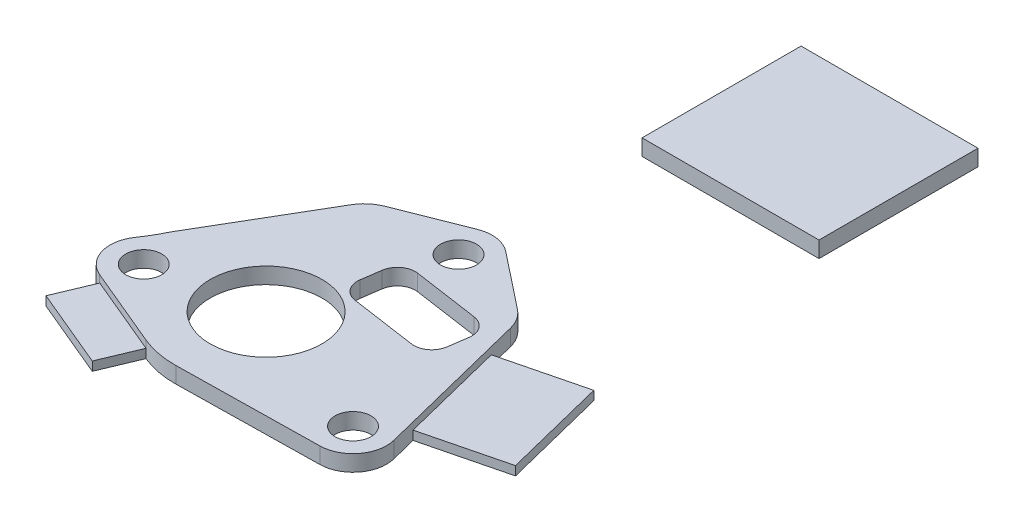
from build123d import *

# Parameters (mm, degrees)
BOSS_EXTRUDE4_DEPTH              = 4.7625
CUT_EXTRUDE1_REACH               = 271.353
SKETCH6_R                        = 14.26845
SKETCH6_R_2                      = 22.86
CUT_EXTRUDE2_REACH               = 271.353
SKETCH7_R                        = 18.48095
CUT_EXTRUDE4_DEPTH               = 270.352829076
BOSS_EXTRUDE9_START              = -4.7625
BOSS_EXTRUDE9_DEPTH              = 4.7625
FILLET1_R                        = 7.62
F_10_CLEARANCE_HOLE1_D           = 4.9784
FILLET4_R                        = 50.8
F_8_32_TAPPED_HOLE1_D            = 3.4544
PIVOTING_BEAM_SENSOR_MOUNT_REACH = 271.268
SKETCH37_R                       = 1.5
SKETCH38_R                       = 7.91845
ENCODER_BOARD_ADDON_DEPTH        = 4.7625
F_10_32_TAPPED_HOLE1_D           = 4.0386
F_10_CLEARANCE_HOLE3_D           = 5.1054
SKETCH47_OUTSIDE_W               = 192.439
SKETCH47_OUTSIDE_H               = 382.734
SKETCH47_OUTSIDE_R               = 2.5527
CUT_EXTRUDE8_DEPTH               = 270.267923318
SKETCH47_2_R                     = 2.5527
CUT_EXTRUDE9_DEPTH               = 2.4765
BOSS_EXTRUDE17_DEPTH             = 1.27
SKETCH59_W                       = 25.070606449
SKETCH59_H                       = 22.525049467
BOSS_EXTRUDE18_DEPTH             = 2.286


with BuildPart() as part:
    # Sketch1 → Boss-Extrude4 (new body)
    with BuildSketch(Plane(origin=(0, 0, 0), x_dir=(1, 0, 0), z_dir=(0, 1, 0))):
        with BuildLine():
            Line((-48.759061319, 205.201963751), (-63.900240413, 124.413609674))
            Line((-63.900240413, 124.413609674), (-26.343120253, -7.50014102))
            ThreePointArc((-26.343120253, -7.50014102), (3.91326684, -27.109010359), (27.388801541, 0.256222825))
            ThreePointArc((27.388801541, 0.256222825), (34.508498918, 53.661639681), (56.295976161, 102.93774419))
            ThreePointArc((56.295976161, 102.93774419), (56.986751486, 124.47275891), (38.624985881, 135.745717413))
            ThreePointArc((38.624985881, 135.745717413), (4.94281576, 154.646064466), (1.637545013, 193.127058321))
            Line((1.637545013, 193.127058321), (18.706481277, 233.364638746))
            ThreePointArc((18.706481277, 233.364638746), (10.708035835, 258.569637187), (-15.424905572, 254.527799821))
            Line((-15.424905572, 254.527799821), (-37.390675283, 228.913568565))
            ThreePointArc((-37.390675283, 228.913568565), (-44.635714299, 217.806104366), (-48.759061319, 205.201963751))
        make_face()
    extrude(amount=BOSS_EXTRUDE4_DEPTH)

    # Sketch6 → Cut-Extrude1 (cut, up to next)
    with BuildSketch(Plane(origin=(0, 4.7625, 0), x_dir=(1, 0, 0), z_dir=(0, 1, 0)), mode=Mode.PRIVATE) as cut_extrude1_sk1:
        with Locations(Location((38.1, 114.3, 0), (0, 0, 270))):
            Circle(SKETCH6_R)
    cut_extrude1_tool1 = extrude(cut_extrude1_sk1.sketch, amount=-CUT_EXTRUDE1_REACH, mode=Mode.PRIVATE) & part.part
    # Sketch6 → Cut-Extrude1 (cut, up to next)
    with BuildSketch(Plane(origin=(0, 4.7625, 0), x_dir=(1, 0, 0), z_dir=(0, 1, 0)), mode=Mode.PRIVATE) as cut_extrude1_sk2:
        with Locations(Location((-4.294087555, 47.653799352, 0), (0, 0, 270))):
            Circle(SKETCH6_R_2)
    cut_extrude1_tool2 = extrude(cut_extrude1_sk2.sketch, amount=-CUT_EXTRUDE1_REACH, mode=Mode.PRIVATE) & part.part
    # Sketch6 → Cut-Extrude1 (cut, up to next)
    with BuildSketch(Plane(origin=(0, 4.7625, 0), x_dir=(1, 0, 0), z_dir=(0, 1, 0)), mode=Mode.PRIVATE) as cut_extrude1_sk3:
        with Locations(Location((-25.238541156, 93.240320194, 0), (0, 0, 270))):
            Circle(SKETCH6_R)
    cut_extrude1_tool3 = extrude(cut_extrude1_sk3.sketch, amount=-CUT_EXTRUDE1_REACH, mode=Mode.PRIVATE) & part.part
    # Sketch6 → Cut-Extrude1 (cut, up to next)
    with BuildSketch(Plane(origin=(0, 4.7625, 0), x_dir=(1, 0, 0), z_dir=(0, 1, 0)), mode=Mode.PRIVATE) as cut_extrude1_sk4:
        with Locations(Location((-31.378993813, 133.413749735, 0), (0, 0, 270))):
            Circle(SKETCH6_R)
    cut_extrude1_tool4 = extrude(cut_extrude1_sk4.sketch, amount=-CUT_EXTRUDE1_REACH, mode=Mode.PRIVATE) & part.part
    # Sketch6 → Cut-Extrude1 (cut, up to next)
    with BuildSketch(Plane(origin=(0, 4.7625, 0), x_dir=(1, 0, 0), z_dir=(0, 1, 0)), mode=Mode.PRIVATE) as cut_extrude1_sk5:
        with Locations(Location((0, 241.3, 0), (0, 0, 270))):
            Circle(SKETCH6_R)
    cut_extrude1_tool5 = extrude(cut_extrude1_sk5.sketch, amount=-CUT_EXTRUDE1_REACH, mode=Mode.PRIVATE) & part.part
    add(cut_extrude1_tool1.solids().sort_by_distance((38.1, 4.7625, -114.3))[0], mode=Mode.SUBTRACT)
    add(cut_extrude1_tool2.solids().sort_by_distance((-4.294088, 4.7625, -47.653799))[0], mode=Mode.SUBTRACT)
    add(cut_extrude1_tool3.solids().sort_by_distance((-25.238541, 4.7625, -93.24032))[0], mode=Mode.SUBTRACT)
    add(cut_extrude1_tool4.solids().sort_by_distance((-31.378994, 4.7625, -133.41375))[0], mode=Mode.SUBTRACT)
    add(cut_extrude1_tool5.solids().sort_by_distance((0, 4.7625, -241.3))[0], mode=Mode.SUBTRACT)

    # Sketch7 → Cut-Extrude2 (cut, up to next)
    with BuildSketch(Plane(origin=(0, 4.7625, 0), x_dir=(1, 0, 0), z_dir=(0, 1, 0)), mode=Mode.PRIVATE) as cut_extrude2_sk1:
        with Locations(Location((0, 0, 0), (0, 0, 270))):
            Circle(SKETCH7_R)
    cut_extrude2_tool1 = extrude(cut_extrude2_sk1.sketch, amount=-CUT_EXTRUDE2_REACH, mode=Mode.PRIVATE) & part.part
    add(cut_extrude2_tool1.solids().sort_by_distance((0, 4.7625, 0))[0], mode=Mode.SUBTRACT)

    # Sketch11 → Cut-Extrude4 (cut, through all)
    with BuildSketch(Plane(origin=(0, 4.7625, 0), x_dir=(1, 0, 0), z_dir=(0, 1, 0))):
        with BuildLine():
            Line((-14.24681913, 167.157327815), (-22.781165939, 169.646710179))
            ThreePointArc((-22.781165939, 169.646710179), (-24.940081812, 173.583756312), (-21.003035679, 175.742672185))
            Line((-21.003035679, 175.742672185), (-12.46868887, 173.253289821))
            ThreePointArc((-12.46868887, 173.253289821), (-10.309772997, 169.316243688), (-14.24681913, 167.157327815))
        make_face()
    extrude(amount=-CUT_EXTRUDE4_DEPTH, mode=Mode.SUBTRACT)

    # Sketch22 → Boss-Extrude9 (add)
    with BuildSketch(Plane(origin=(0, 4.7625, 0), x_dir=(1, 0, 0), z_dir=(0, 1, 0)).offset(BOSS_EXTRUDE9_START)):
        with BuildLine():
            Line((44.13587102, -0.238974107), (45.721176973, 83.59457079))
            ThreePointArc((45.721176973, 83.59457079), (31.828729714, 42.965057017), (27.388801541, 0.256222825))
            ThreePointArc((27.388801541, 0.256222825), (27.389946843, 0.053962259), (27.389598514, -0.14830125))
            Line((27.389598514, -0.14830125), (44.13587102, -0.238974107))
        make_face()
        with BuildLine():
            Line((-26.343120253, -7.50014102), (-63.900240413, 124.413609674))
            Line((-63.900240413, 124.413609674), (-58.659130106, 55.341604227))
            ThreePointArc((-58.659130106, 55.341604227), (-58.57862185, 54.70676299), (-58.434627096, 54.083248366))
            Line((-58.434627096, 54.083248366), (-39.267840062, -13.237215919))
            Line((-39.267840062, -13.237215919), (-25.732483938, -9.383569172))
            ThreePointArc((-25.732483938, -9.383569172), (-26.054826105, -8.447374541), (-26.343120253, -7.50014102))
        make_face()
    extrude(amount=BOSS_EXTRUDE9_DEPTH)

    # Fillet1
    fillet1_edges = [part.edges().sort_by_distance(p)[0] for p in [
        (44.13587102, 2.38125, 0.238974107),
        (27.389598514, 2.38125, 0.14830125),
        (45.721176973, 2.38125, -83.59457079),
        (-25.732483938, 2.38125, 9.383569172),
    ]]
    fillet(fillet1_edges, radius=FILLET1_R)

    # #10 Clearance Hole1 (through all)
    with Locations(Plane(origin=(0, 4.7625, 0), x_dir=(1, 0, 0), z_dir=(0, 1, 0))):
        with Locations((-20.169087555, 23.894274946), (-52.327331966, 55.822054335), (31.486575952, 69.734116153), (0.686224782, 152.463749735), (-32.612193782, 193.553892754), (-52.098807962, 161.528602156)):
            Hole(F_10_CLEARANCE_HOLE1_D / 2)

    # Fillet4
    fillet4_edges = [part.edges().sort_by_distance(p)[0] for p in [
        (-63.900240413, 2.38125, -124.413609674),
    ]]
    fillet(fillet4_edges, radius=FILLET4_R)

    # #8-32 Tapped Hole1 (through all)
    with Locations(Plane(origin=(0, 4.7625, 0), x_dir=(1, 0, 0), z_dir=(0, 1, 0))):
        with Locations((1.914830287, -21.24990167), (13.247190201, 16.725335505), (-17.940310329, 11.548599972)):
            Hole(F_8_32_TAPPED_HOLE1_D / 2)

    # Sketch37 → Pivoting Beam Sensor Mount (cut, up to next)
    with BuildSketch(Plane.XZ, mode=Mode.PRIVATE) as pivoting_beam_sensor_mount_sk1:
        with Locations(Location((23.083384984, -92.174973762, 0), (0, 0, 270))):
            Circle(SKETCH37_R)
    pivoting_beam_sensor_mount_tool1 = extrude(pivoting_beam_sensor_mount_sk1.sketch, amount=-PIVOTING_BEAM_SENSOR_MOUNT_REACH, mode=Mode.PRIVATE) & part.part
    # Sketch37 → Pivoting Beam Sensor Mount (cut, up to next)
    with BuildSketch(Plane.XZ, mode=Mode.PRIVATE) as pivoting_beam_sensor_mount_sk2:
        with BuildLine():
            ThreePointArc((-3.647543534, -89.163751321), (-3.541377345, -96.013206549), (-1.708587973, -102.613751321))
            ThreePointArc((-1.708587973, -102.613751321), (0.255952019, -103.414115377), (1.056316075, -101.449575385))
            ThreePointArc((1.056316075, -101.449575385), (-0.572072996, -95.585150848), (-0.666399089, -89.499575385))
            ThreePointArc((-0.666399089, -89.499575385), (-1.989059279, -87.841091131), (-3.647543534, -89.163751321))
        make_face()
    pivoting_beam_sensor_mount_tool2 = extrude(pivoting_beam_sensor_mount_sk2.sketch, amount=-PIVOTING_BEAM_SENSOR_MOUNT_REACH, mode=Mode.PRIVATE) & part.part
    add(pivoting_beam_sensor_mount_tool1.solids().sort_by_distance((23.083385, 0, -92.174974))[0], mode=Mode.SUBTRACT)
    add(pivoting_beam_sensor_mount_tool2.solids().sort_by_distance((-1.700962, 0, -95.747892))[0], mode=Mode.SUBTRACT)

    # Sketch38 → Encoder Board Addon (add)
    with BuildSketch(Plane(origin=(0, 4.7625, 0), x_dir=(1, 0, 0), z_dir=(0, 1, 0))):
        with BuildLine():
            Line((-37.529034093, -19.344511049), (-39.267840062, -13.237215919))
            Line((-39.267840062, -13.237215919), (-31.839812047, -11.12238453))
            ThreePointArc((-31.839812047, -11.12238453), (-27.003669081, -11.344505665), (-23.277388672, -14.435209614))
            ThreePointArc((-23.277388672, -14.435209614), (-5.966086008, -26.732338427), (14.931018089, -22.962508548))
            ThreePointArc((14.931018089, -22.962508548), (8.591508195, -29.075813245), (4.9829433, -37.109501029))
            Line((4.9829433, -37.109501029), (2.47141259, -47.765086321))
            ThreePointArc((2.47141259, -47.765086321), (0.822880543, -50.381887664), (-2.085320348, -51.434348945))
            Line((-2.085320348, -51.434348945), (-22.168826979, -51.766465319))
            ThreePointArc((-22.168826979, -51.766465319), (-24.841143263, -51.533840241), (-27.408807967, -50.757640062))
            Line((-27.408807967, -50.757640062), (-38.693349579, -46.027393508))
            ThreePointArc((-38.693349579, -46.027393508), (-41.42356145, -42.97092165), (-40.768594617, -38.925294934))
            ThreePointArc((-40.768594617, -38.925294934), (-36.952648742, -29.498249601), (-37.529034093, -19.344511049))
        make_face()
        with Locations(Location((-22.38375, -38.769792264, 0), (0, 0, 270))):
            Circle(SKETCH38_R, mode=Mode.SUBTRACT)
    extrude(amount=-ENCODER_BOARD_ADDON_DEPTH)

    # #10-32 Tapped Hole1 (through all)
    with Locations(Plane(origin=(0, 4.7625, 0), x_dir=(1, 0, 0), z_dir=(0, 1, 0))):
        with Locations((-2.164065959, -46.6725), (-36.852219401, -41.635167886), (-15.755793253, -18.133994079)):
            Hole(F_10_32_TAPPED_HOLE1_D / 2)

    # #10 Clearance Hole3 (through all)
    with Locations(Plane(origin=(0, 4.7625, 0), x_dir=(1, 0, 0), z_dir=(0, 1, 0))):
        with Locations((-36.852219401, -41.635167886), (-2.164065959, -46.6725)):
            Hole(F_10_CLEARANCE_HOLE3_D / 2)

    # Sketch47 outside → Cut-Extrude8 (cut, through all)
    # profile 1 of 3: a face of its own
    with BuildSketch(Plane(origin=(0, 4.7625, 0), x_dir=(1, 0, 0), z_dir=(0, 1, 0))):
        with Locations((-1.9945, 104.926)):
            Rectangle(SKETCH47_OUTSIDE_W, SKETCH47_OUTSIDE_H)
        with BuildLine():
            Line((-38.693349579, -46.027393508), (-27.408807967, -50.757640062))
            ThreePointArc((-27.408807967, -50.757640062), (-24.841143263, -51.533840241), (-22.168826979, -51.766465319))
            Line((-22.168826979, -51.766465319), (-2.085320348, -51.434348945))
            ThreePointArc((-2.085320348, -51.434348945), (1.613604275, -49.572605834), (2.456445703, -45.518256427))
            Line((2.456445703, -45.518256427), (-3.055299638, -23.454383414))
            ThreePointArc((-3.055299638, -23.454383414), (-3.715825704, -21.93050709), (-4.832568275, -20.701125227))
            Line((-4.832568275, -20.701125227), (-12.801470938, -14.398570955))
            ThreePointArc((-12.801470938, -14.398570955), (-15.063238725, -13.422118181), (-17.510319119, -13.706461444))
            Line((-17.510319119, -13.706461444), (-26.955722074, -17.449449957))
            ThreePointArc((-26.955722074, -17.449449957), (-28.392130747, -18.316742481), (-29.467648755, -19.604658322))
            Line((-29.467648755, -19.604658322), (-40.96167653, -39.228143092))
            ThreePointArc((-40.96167653, -39.228143092), (-41.369942708, -43.14234484), (-38.693349579, -46.027393508))
        make_face(mode=Mode.SUBTRACT)
    # profile 2 of 3: a face of its own
    with BuildSketch(Plane(origin=(0, 4.7625, 0), x_dir=(1, 0, 0), z_dir=(0, 1, 0))):
        with Locations(Location((-15.755793253, -18.133994079, 0), (0, 0, 270))):
            Circle(SKETCH47_OUTSIDE_R)
    # profile 3 of 3: a face of its own
    with BuildSketch(Plane(origin=(0, 4.7625, 0), x_dir=(1, 0, 0), z_dir=(0, 1, 0))):
        with BuildLine():
            Line((-4.84593204, -27.549630083), (-5.242572374, -30.280980815))
            ThreePointArc((-5.242572374, -30.280980815), (-6.23690981, -31.951475606), (-8.121230748, -32.429591056))
            Line((-8.121230748, -32.429591056), (-17.48303399, -31.070091993))
            ThreePointArc((-17.48303399, -31.070091993), (-19.153528781, -30.075754557), (-19.631644231, -28.191433619))
            Line((-19.631644231, -28.191433619), (-19.235003898, -25.460082887))
            ThreePointArc((-19.235003898, -25.460082887), (-18.240666462, -23.789588097), (-16.356345524, -23.311472646))
            Line((-16.356345524, -23.311472646), (-6.994542282, -24.67097171))
            ThreePointArc((-6.994542282, -24.67097171), (-5.324047491, -25.665309145), (-4.84593204, -27.549630083))
        make_face()
    extrude(amount=-CUT_EXTRUDE8_DEPTH, mode=Mode.SUBTRACT)

    # Sketch47<2> → Cut-Extrude9 (cut)
    with BuildSketch(Plane(origin=(0, 4.7625, 0), x_dir=(1, 0, 0), z_dir=(0, 1, 0))):
        with BuildLine():
            Line((-38.693349579, -46.027393508), (-27.408807967, -50.757640062))
            ThreePointArc((-27.408807967, -50.757640062), (-24.841143263, -51.533840241), (-22.168826979, -51.766465319))
            Line((-22.168826979, -51.766465319), (-2.085320348, -51.434348945))
            ThreePointArc((-2.085320348, -51.434348945), (1.613604275, -49.572605834), (2.456445703, -45.518256427))
            Line((2.456445703, -45.518256427), (-3.055299638, -23.454383414))
            ThreePointArc((-3.055299638, -23.454383414), (-3.715825704, -21.93050709), (-4.832568275, -20.701125227))
            Line((-4.832568275, -20.701125227), (-12.801470938, -14.398570955))
            ThreePointArc((-12.801470938, -14.398570955), (-15.063238725, -13.422118181), (-17.510319119, -13.706461444))
            Line((-17.510319119, -13.706461444), (-26.955722074, -17.449449957))
            ThreePointArc((-26.955722074, -17.449449957), (-28.392130747, -18.316742481), (-29.467648755, -19.604658322))
            Line((-29.467648755, -19.604658322), (-40.96167653, -39.228143092))
            ThreePointArc((-40.96167653, -39.228143092), (-41.369942708, -43.14234484), (-38.693349579, -46.027393508))
        make_face()
        with Locations(Location((-15.755793253, -18.133994079, 0), (0, 0, 270))):
            Circle(SKETCH47_2_R, mode=Mode.SUBTRACT)
        with BuildLine():
            Line((-4.84593204, -27.549630083), (-5.242572374, -30.280980815))
            ThreePointArc((-5.242572374, -30.280980815), (-6.23690981, -31.951475606), (-8.121230748, -32.429591056))
            Line((-8.121230748, -32.429591056), (-17.48303399, -31.070091993))
            ThreePointArc((-17.48303399, -31.070091993), (-19.153528781, -30.075754557), (-19.631644231, -28.191433619))
            Line((-19.631644231, -28.191433619), (-19.235003898, -25.460082887))
            ThreePointArc((-19.235003898, -25.460082887), (-18.240666462, -23.789588097), (-16.356345524, -23.311472646))
            Line((-16.356345524, -23.311472646), (-6.994542282, -24.67097171))
            ThreePointArc((-6.994542282, -24.67097171), (-5.324047491, -25.665309145), (-4.84593204, -27.549630083))
        make_face(mode=Mode.SUBTRACT)
    extrude(amount=-CUT_EXTRUDE9_DEPTH, mode=Mode.SUBTRACT)

    # Sketch57 → Boss-Extrude17 (add)
    with BuildSketch(Plane.XZ):
        Polygon((-2.146216684, 27.09350126), (1.54736275, 41.87913858), (13.16374728, 38.977265765), (9.470167845, 24.191628444), align=None)
        Polygon((-38.693349579, 46.027393508), (-27.408807967, 50.757640062), (-29.658175238, 56.12376174), (-40.942716851, 51.393515186), align=None)
    extrude(amount=-BOSS_EXTRUDE17_DEPTH)


with BuildPart() as body_2:
    # Sketch59 → Boss-Extrude18 (new body)
    with BuildSketch(Plane.XZ):
        with Locations((-4.539267441, -20.455372988)):
            Rectangle(SKETCH59_W, SKETCH59_H)
    extrude(amount=-BOSS_EXTRUDE18_DEPTH)


solid = Compound([part.part, body_2.part])
